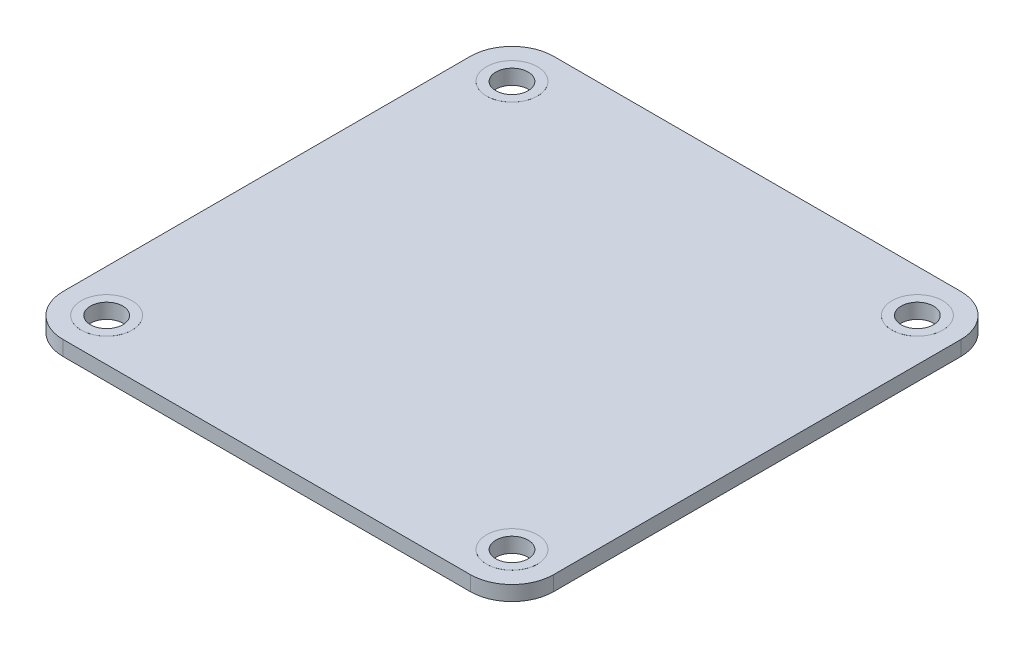
from build123d import *

# Parameters (mm, degrees)
SKETCH1_R           = 1.755
BOSS_EXTRUDE1_DEPTH = 1.6
BOSS_EXTRUDE2_START = 0.8
SKETCH2_R           = 2.75
SKETCH2_R_2         = 1.75
BOSS_EXTRUDE2_DEPTH = 0.805


with BuildPart() as part:
    # Sketch1 → Boss-Extrude1 (new body)
    with BuildSketch(Plane(origin=(0, 0, 0), x_dir=(1, 0, 0), z_dir=(0, 1, 0))):
        with BuildLine():
            Line((22, -26.5), (-22, -26.5))
            ThreePointArc((-22, -26.5), (-25.181980515, -25.181980515), (-26.5, -22))
            Line((-26.5, -22), (-26.5, 22))
            ThreePointArc((-26.5, 22), (-25.181980515, 25.181980515), (-22, 26.5))
            Line((-22, 26.5), (22, 26.5))
            ThreePointArc((22, 26.5), (25.181980515, 25.181980515), (26.5, 22))
            Line((26.5, 22), (26.5, -22))
            ThreePointArc((26.5, -22), (25.181980515, -25.181980515), (22, -26.5))
        make_face()
        with Locations(Location((-21.9, 21.9, 0), (0, 0, 270))):
            Circle(SKETCH1_R, mode=Mode.SUBTRACT)
        with Locations(Location((21.9, 21.9, 0), (0, 0, 270))):
            Circle(SKETCH1_R, mode=Mode.SUBTRACT)
        with Locations(Location((-21.9, -21.9, 0), (0, 0, 270))):
            Circle(SKETCH1_R, mode=Mode.SUBTRACT)
        with Locations(Location((21.9, -21.9, 0), (0, 0, 270))):
            Circle(SKETCH1_R, mode=Mode.SUBTRACT)
    extrude(amount=BOSS_EXTRUDE1_DEPTH)

    # Sketch2 → Boss-Extrude2 (add, symmetric)
    # profile 1 of 4: a face of its own
    with BuildSketch(Plane(origin=(0, 0, 0), x_dir=(1, 0, 0), z_dir=(0, 1, 0)).offset(BOSS_EXTRUDE2_START)):
        with Locations(Location((-21.9, 21.9, 0), (0, 0, 90))):
            Circle(SKETCH2_R)
        with Locations(Location((-21.9, 21.9, 0), (0, 0, 90))):
            Circle(SKETCH2_R_2, mode=Mode.SUBTRACT)
    # profile 2 of 4: a face of its own
    with BuildSketch(Plane(origin=(0, 0, 0), x_dir=(1, 0, 0), z_dir=(0, 1, 0)).offset(BOSS_EXTRUDE2_START)):
        with Locations(Location((21.9, 21.9, 0), (0, 0, 90))):
            Circle(SKETCH2_R)
        with Locations(Location((21.9, 21.9, 0), (0, 0, 90))):
            Circle(SKETCH2_R_2, mode=Mode.SUBTRACT)
    # profile 3 of 4: a face of its own
    with BuildSketch(Plane(origin=(0, 0, 0), x_dir=(1, 0, 0), z_dir=(0, 1, 0)).offset(BOSS_EXTRUDE2_START)):
        with Locations(Location((21.9, -21.9, 0), (0, 0, 90))):
            Circle(SKETCH2_R)
        with Locations(Location((21.9, -21.9, 0), (0, 0, 90))):
            Circle(SKETCH2_R_2, mode=Mode.SUBTRACT)
    # profile 4 of 4: a face of its own
    with BuildSketch(Plane(origin=(0, 0, 0), x_dir=(1, 0, 0), z_dir=(0, 1, 0)).offset(BOSS_EXTRUDE2_START)):
        with Locations(Location((-21.9, -21.9, 0), (0, 0, 90))):
            Circle(SKETCH2_R)
        with Locations(Location((-21.9, -21.9, 0), (0, 0, 90))):
            Circle(SKETCH2_R_2, mode=Mode.SUBTRACT)
    extrude(amount=BOSS_EXTRUDE2_DEPTH, both=True)


solid = part.part
